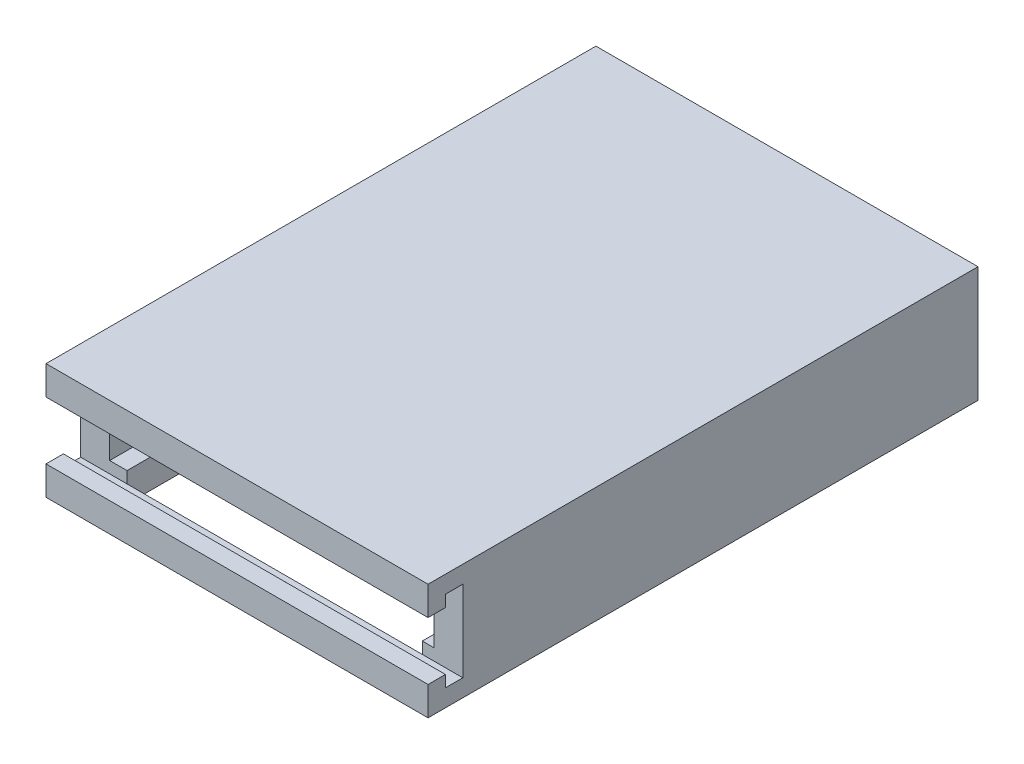
from build123d import *

# Parameters (mm, degrees)
EXTRUDE_1_DEPTH = 84
SKETCH_2_W      = 8
SKETCH_2_H      = 84
SKETCH_2_W_2    = 7
EXTRUDE_2_DEPTH = 5
SKETCH_3_W      = 66
SKETCH_3_H      = 20
EXTRUDE_3_DEPTH = 5
EXTRUDE_4_DEPTH = 66


with BuildPart() as part:
    # 스케치1 → 보스-돌출1 (new body)
    with BuildSketch(Plane.XY):
        Polygon((-5, 0), (0, 0), (0, 10), (56, 10), (56, 0), (61, 0), (61, 15), (-5, 15), align=None)
    extrude(amount=EXTRUDE_1_DEPTH)

    # 스케치2 → 보스-돌출2 (add)
    with BuildSketch(Plane.XZ):
        with Locations((-1, 42)):
            Rectangle(SKETCH_2_W, SKETCH_2_H)
        with Locations((57.5, 42)):
            Rectangle(SKETCH_2_W_2, SKETCH_2_H)
    extrude(amount=EXTRUDE_2_DEPTH)

    # 스케치3 → 보스-돌출3 (add)
    with BuildSketch(Plane(origin=(0, 0, 0), x_dir=(-1, 0, 0), z_dir=(0, 0, -1))):
        with Locations((-28, 5)):
            Rectangle(SKETCH_3_W, SKETCH_3_H)
    extrude(amount=EXTRUDE_3_DEPTH)

    # 스케치4 → 보스-돌출4 (add)
    with BuildSketch(Plane.ZY.offset(5)):
        Polygon((84, 15), (90, 15), (90, 10), (87, 10), (87, 12), (84, 12), align=None)
        Polygon((84, -5), (90, -5), (90, 0), (87, 0), (87, -2), (84, -2), align=None)
    extrude(amount=-EXTRUDE_4_DEPTH)


solid = part.part
